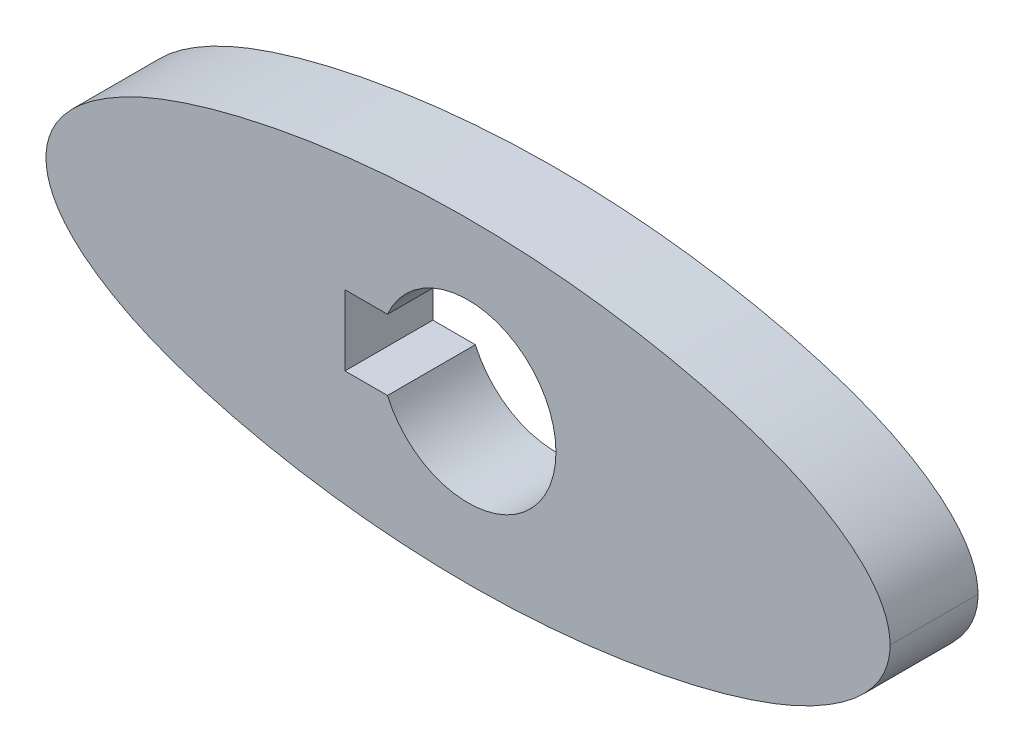
from build123d import *

# Parameters (mm, degrees)
SALIENTE_EXTRUIR1_DEPTH = 5


with BuildPart() as part:
    # Croquis1 → Saliente-Extruir1 (new body)
    with BuildSketch(Plane.XY):
        with BuildLine():
            add(Edge.make_bspline(
                [(29.937276525, -5.831632653), (29.937276525, -4.331632653), (28.977276525, -2.351632653), (21.297276525, 1.488367347), (13.937276525, 3.168367347), (-2.062723475, 3.168367347), (-9.422723475, 1.488367347), (-17.102723475, -2.351632653), (-18.062723475, -4.331632653), (-18.062723475, -5.831632653)],
                knots=[0, 0, 0, 0, 0.25, 0.25, 0.5, 0.5, 0.75, 0.75, 1, 1, 1, 1], degree=3))
            add(Edge.make_bspline(
                [(-18.062723475, -5.831632653), (-18.062723475, -7.331632653), (-17.102723475, -9.311632653), (-9.422723475, -13.151632653), (-2.062723475, -14.831632653), (13.937276525, -14.831632653), (21.297276525, -13.151632653), (28.977276525, -9.311632653), (29.937276525, -7.331632653), (29.937276525, -5.831632653)],
                knots=[0, 0, 0, 0, 0.25, 0.25, 0.5, 0.5, 0.75, 0.75, 1, 1, 1, 1], degree=3))
        make_face()
        with BuildLine():
            Line((-1.062723475, -3.831632653), (1.35470083, -3.831632653))
            ThreePointArc((1.35470083, -3.831632653), (10.937276525, -5.831632653), (1.35470083, -7.831632653))
            Line((1.35470083, -7.831632653), (-1.062723475, -7.831632653))
            Line((-1.062723475, -7.831632653), (-1.062723475, -3.831632653))
        make_face(mode=Mode.SUBTRACT)
    extrude(amount=SALIENTE_EXTRUIR1_DEPTH)


solid = part.part
